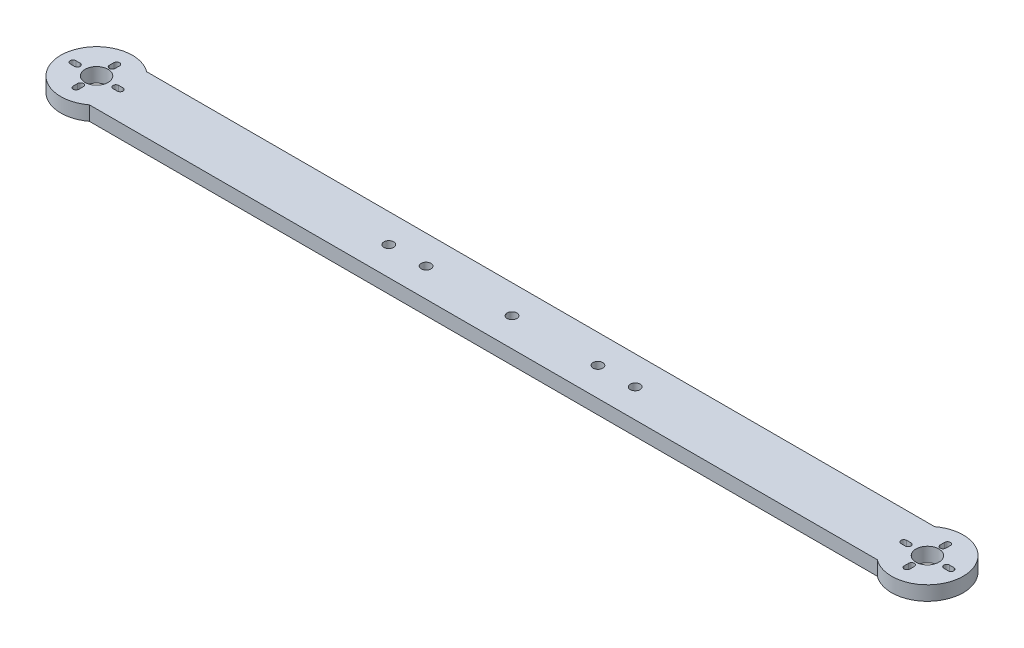
from build123d import *

# Parameters (mm, degrees)
BOSS_EXTRUDE1_DEPTH = 6.35
SKETCH2_R           = 5.08
CUT_EXTRUDE1_DEPTH  = 201.754423986
SKETCH3_R           = 2.159
CUT_EXTRUDE2_DEPTH  = 201.754423986
SKETCH6_R           = 2.159
CUT_EXTRUDE3_DEPTH  = 6.35


with BuildPart() as part:
    # Sketch1 → Boss-Extrude1 (new body)
    with BuildSketch(Plane(origin=(0, 0, 0), x_dir=(1, 0, 0), z_dir=(0, 1, 0))):
        with BuildLine():
            Line((-174.625, 12.7), (174.625, 12.7))
            ThreePointArc((174.625, 12.7), (200.025, 0), (174.625, -12.7))
            Line((174.625, -12.7), (-174.625, -12.7))
            ThreePointArc((-174.625, -12.7), (-200.025, 0), (-174.625, 12.7))
        make_face()
    extrude(amount=BOSS_EXTRUDE1_DEPTH)

    # Sketch2 → Cut-Extrude1 (cut, through all)
    with BuildSketch(Plane(origin=(0, 6.35, 0), x_dir=(1, 0, 0), z_dir=(0, 1, 0))):
        with Locations(Location((184.15, 0, 0), (0, 0, 270))):
            Circle(SKETCH2_R)
        with Locations(Location((-184.15, 0, 0), (0, 0, 90))):
            Circle(SKETCH2_R)
        with BuildLine():
            Line((173.691383345, 1.25), (175.608616655, 1.25))
            ThreePointArc((175.608616655, 1.25), (176.858616655, 0), (175.608616655, -1.25))
            Line((175.608616655, -1.25), (173.691383345, -1.25))
            ThreePointArc((173.691383345, -1.25), (172.441383345, 0), (173.691383345, 1.25))
        make_face()
        with BuildLine():
            Line((194.608616655, 1.25), (192.691383345, 1.25))
            ThreePointArc((192.691383345, 1.25), (191.441383345, 0), (192.691383345, -1.25))
            Line((192.691383345, -1.25), (194.608616655, -1.25))
            ThreePointArc((194.608616655, -1.25), (195.858616655, 0), (194.608616655, 1.25))
        make_face()
        with BuildLine():
            Line((185.4, 8.920928665), (185.4, 6.921035691))
            ThreePointArc((185.4, 6.921035691), (184.15, 5.671035691), (182.9, 6.921035691))
            Line((182.9, 6.921035691), (182.9, 8.920928665))
            ThreePointArc((182.9, 8.920928665), (184.15, 10.170928665), (185.4, 8.920928665))
        make_face()
        with BuildLine():
            Line((185.441381345, -9.078964309), (185.441381345, -7.078964309))
            ThreePointArc((185.441381345, -7.078964309), (184.191381345, -5.828964309), (182.941381345, -7.078964309))
            Line((182.941381345, -7.078964309), (182.941381345, -9.078964309))
            ThreePointArc((182.941381345, -9.078964309), (184.191381345, -10.328964309), (185.441381345, -9.078964309))
        make_face()
        with BuildLine():
            Line((-185.441381345, -9.078964309), (-185.441381345, -7.078964309))
            ThreePointArc((-185.441381345, -7.078964309), (-184.191381345, -5.828964309), (-182.941381345, -7.078964309))
            Line((-182.941381345, -7.078964309), (-182.941381345, -9.078964309))
            ThreePointArc((-182.941381345, -9.078964309), (-184.191381345, -10.328964309), (-185.441381345, -9.078964309))
        make_face()
        with BuildLine():
            Line((-185.4, 8.920928665), (-185.4, 6.921035691))
            ThreePointArc((-185.4, 6.921035691), (-184.15, 5.671035691), (-182.9, 6.921035691))
            Line((-182.9, 6.921035691), (-182.9, 8.920928665))
            ThreePointArc((-182.9, 8.920928665), (-184.15, 10.170928665), (-185.4, 8.920928665))
        make_face()
        with BuildLine():
            Line((-194.608616655, 1.25), (-192.691383345, 1.25))
            ThreePointArc((-192.691383345, 1.25), (-191.441383345, 0), (-192.691383345, -1.25))
            Line((-192.691383345, -1.25), (-194.608616655, -1.25))
            ThreePointArc((-194.608616655, -1.25), (-195.858616655, 0), (-194.608616655, 1.25))
        make_face()
        with BuildLine():
            Line((-173.691383345, 1.25), (-175.608616655, 1.25))
            ThreePointArc((-175.608616655, 1.25), (-176.858616655, 0), (-175.608616655, -1.25))
            Line((-175.608616655, -1.25), (-173.691383345, -1.25))
            ThreePointArc((-173.691383345, -1.25), (-172.441383345, 0), (-173.691383345, 1.25))
        make_face()
    extrude(amount=-CUT_EXTRUDE1_DEPTH, mode=Mode.SUBTRACT)

    # Sketch3 → Cut-Extrude2 (cut, through all)
    with BuildSketch(Plane(origin=(0, 6.35, 0), x_dir=(1, 0, 0), z_dir=(0, 1, 0))):
        with Locations(Location((0, 0, 0), (0, 0, 270))):
            Circle(SKETCH3_R)
        with Locations(Location((38.1, 0, 0), (0, 0, 270))):
            Circle(SKETCH3_R)
        with Locations(Location((-38.1, 0, 0), (0, 0, 270))):
            Circle(SKETCH3_R)
    extrude(amount=-CUT_EXTRUDE2_DEPTH, mode=Mode.SUBTRACT)

    # Sketch6 → Cut-Extrude3 (cut)
    with BuildSketch(Plane(origin=(0, 0, 0), x_dir=(-1, 0, 0), z_dir=(0, -1, 0))):
        with Locations(Location((54.61, 0, 0), (0, 0, 90))):
            Circle(SKETCH6_R)
        with Locations(Location((-54.61, 0, 0), (0, 0, 90))):
            Circle(SKETCH6_R)
    extrude(amount=-CUT_EXTRUDE3_DEPTH, mode=Mode.SUBTRACT)


solid = part.part
